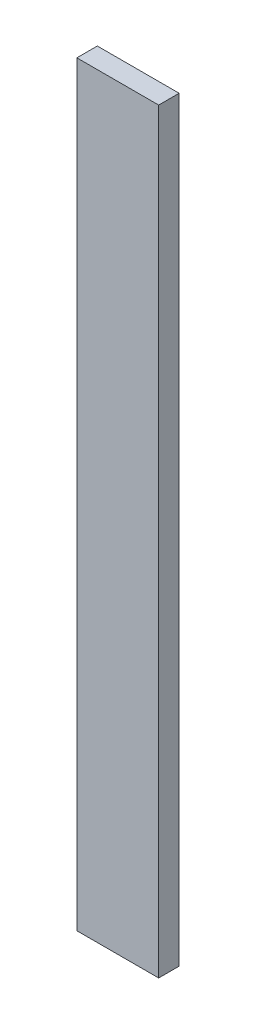
from build123d import *

# Parameters (mm, degrees)
SKETCH1_W           = 25.4
SKETCH1_H           = 234.696
BOSS_EXTRUDE1_DEPTH = 6.35


with BuildPart() as part:
    # Sketch1 → Boss-Extrude1 (new body)
    with BuildSketch(Plane.XY):
        Rectangle(SKETCH1_W, SKETCH1_H)
    extrude(amount=BOSS_EXTRUDE1_DEPTH)


solid = part.part
